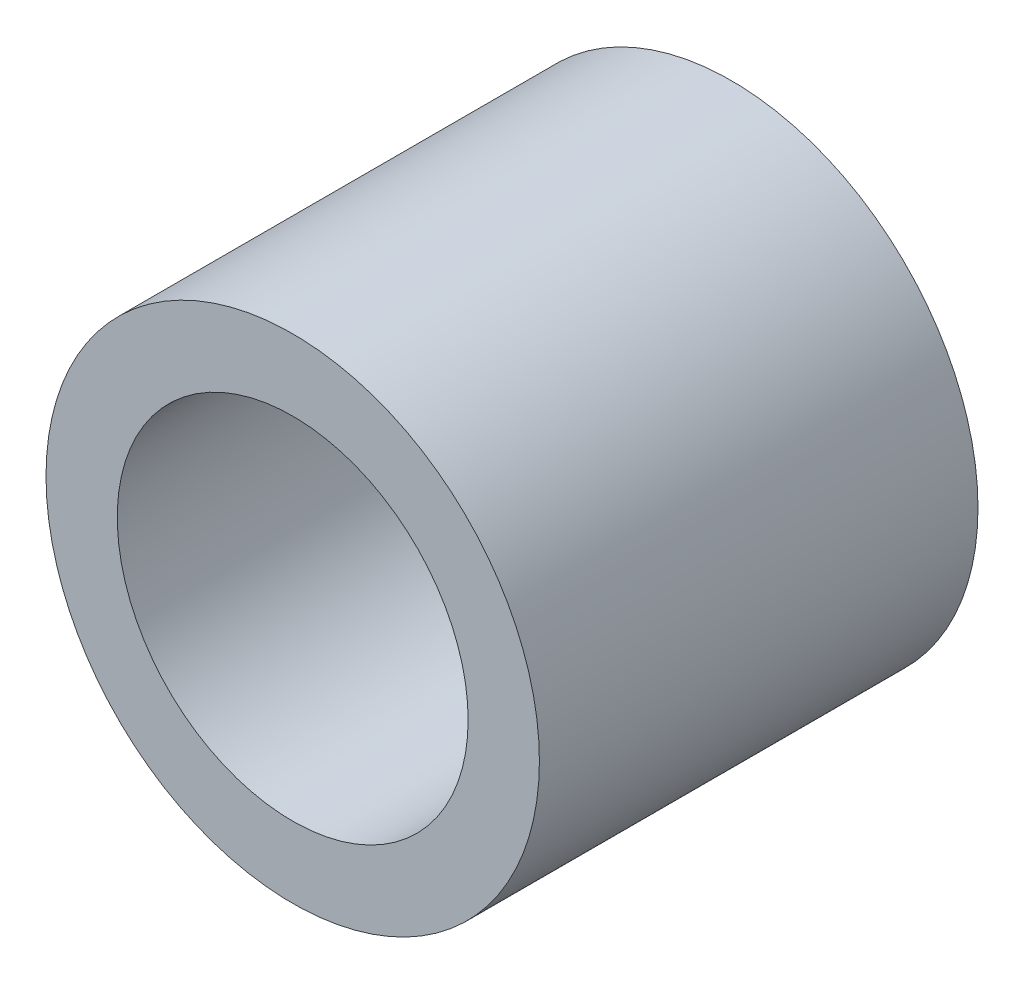
from build123d import *

# Parameters (mm, degrees)
EXTRUDE1_DEPTH      = 2
EXTRUDE1_DEPTH_BACK = 2
SKETCH1_R           = 2.25
SKETCH1_R_2         = 1.6


with BuildPart() as part:
    # Sketch1 → Extrude1 (new, two sides: drawn at the far end of the back side and taken through both)
    with BuildSketch(Plane.XY.offset(-EXTRUDE1_DEPTH_BACK)):
        Circle(SKETCH1_R)
        Circle(SKETCH1_R_2, mode=Mode.SUBTRACT)
    extrude(amount=EXTRUDE1_DEPTH + EXTRUDE1_DEPTH_BACK)


solid = part.part
